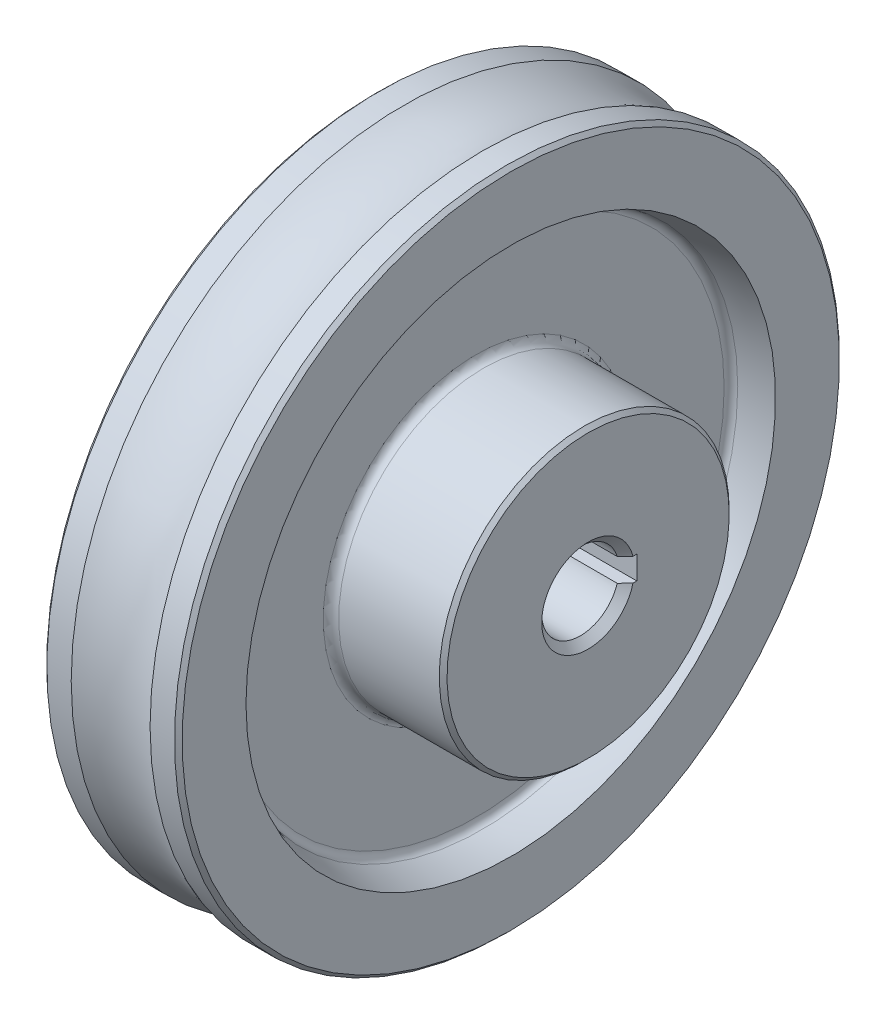
from build123d import *

# Parameters (mm, degrees)
CROQUIS2_R                        = 27
CROQUIS4_R                        = 10
CORTAR_EXTRUIR1_DEPTH             = 134.4803358
CHAFL_N1_SIZE                     = 1
CHAFL_N2_SIZE                     = 2
REDONDEO3_R                       = 2
REDONDEO5_R                       = 2
CORTAR_EXTRUIR2_REACH             = 129.272
CORTAR_EXTRUIR2_DIRECTION_2_REACH = 129.272


with BuildPart() as part:
    # Croquis1 → Revolución1 (revolve)
    with BuildSketch(Plane.XY):
        Polygon((-17.5, 0), (17.5, 0), (37.5, 0), (37.5, 37.5), (17.5, 37.5), (17.5, 86), (-17.5, 86), align=None)
    revolve(axis=Axis((0, 0, 0), (-1, 0, 0)))

    # Croquis2 → Cortar-Revolución1 (revolve, cut)
    with BuildSketch(Plane.XY):
        with Locations((0, 111)):
            Circle(CROQUIS2_R)
    revolve(axis=Axis((0, 0, 0), (-1, 0, 0)), mode=Mode.SUBTRACT)

    # Croquis3 → Cortar-Revolución2 (revolve, cut)
    with BuildSketch(Plane.XY, mode=Mode.PRIVATE) as cortar_revoluci_n2_sk:
        with BuildLine():
            Line((-8.5, 37.5), (-8.5, 65.830873376))
            ThreePointArc((-8.5, 65.830873376), (-13.06832274, 66.93505996), (-17.5, 68.5))
            Line((-17.5, 68.5), (-17.5, 37.5))
            Line((-17.5, 37.5), (-8.5, 37.5))
        make_face()
        with BuildLine():
            Line((8.5, 37.5), (8.5, 65.830873376))
            ThreePointArc((8.5, 65.830873376), (13.06832274, 66.93505996), (17.5, 68.5))
            Line((17.5, 68.5), (17.5, 37.5))
            Line((17.5, 37.5), (8.5, 37.5))
        make_face()
    revolve(cortar_revoluci_n2_sk.sketch.rotate(Axis((0, 0, 0), (1, 0, 0)), 90), axis=Axis((0, 0, 0), (1, 0, 0)), mode=Mode.SUBTRACT)

    # Croquis4 → Cortar-Extruir1 (cut, through all)
    with BuildSketch(Plane(origin=(37.5, 0, 0), x_dir=(0, 0, -1), z_dir=(1, 0, 0))):
        with Locations(Location((0, 0, 0), (0, 0, 90))):
            Circle(CROQUIS4_R)
    extrude(amount=-CORTAR_EXTRUIR1_DEPTH, mode=Mode.SUBTRACT)

    # Chaflán1
    chafl_n1_edges = [part.edges().sort_by_distance(p)[0] for p in [
        (-17.5, 0, -37.5),
        (37.5, -37.5, 0),
        (17.5, -86, 0),
        (-17.5, -86, 0),
    ]]
    chamfer(chafl_n1_edges, length=CHAFL_N1_SIZE)

    # Chaflán2
    chafl_n2_edges = [part.edges().sort_by_distance(p)[0] for p in [
        (-17.5, -10, 0),
        (37.5, -10, 0),
    ]]
    chamfer(chafl_n2_edges, length=CHAFL_N2_SIZE)

    # Redondeo3
    redondeo3_edges = [part.edges().sort_by_distance(p)[0] for p in [
        (-8.5, 0, -65.830873376),
        (8.5, 0, -65.830873376),
    ]]
    fillet(redondeo3_edges, radius=REDONDEO3_R)

    # Redondeo5
    redondeo5_edges = [part.edges().sort_by_distance(p)[0] for p in [
        (-8.5, 0, -37.5),
        (8.5, 0, -37.5),
    ]]
    fillet(redondeo5_edges, radius=REDONDEO5_R)

    # Cortar-Extruir2: up to this face of the body (flat: up to its plane)
    cortar_extruir2_end = Plane(part.part.faces().sort_by_distance((-17.5, -13.032375901, 0))[0])
    # Croquis5 → Cortar-Extruir2 (cut, up to the picked face)
    with BuildSketch(Plane(origin=(0, 0, 0), x_dir=(0, 0, -1), z_dir=(1, 0, 0)), mode=Mode.PRIVATE) as cortar_extruir2_sk1:
        with BuildLine():
            Line((12.6, 0), (12.6, 3))
            Line((12.6, 3), (9.539392014, 3))
            ThreePointArc((9.539392014, 3), (10, 0), (9.539392014, -3))
            Line((9.539392014, -3), (12.6, -3))
            Line((12.6, -3), (12.6, 0))
        make_face()
    cortar_extruir2_tool1 = split(extrude(cortar_extruir2_sk1.sketch, amount=-CORTAR_EXTRUIR2_REACH, mode=Mode.PRIVATE), bisect_by=cortar_extruir2_end, keep=Keep.BOTH, mode=Mode.PRIVATE)
    add(cortar_extruir2_tool1.solids().sort_by(Axis((0, 0, -11.220551), (-1, 0, 0)))[0], mode=Mode.SUBTRACT)

    # Cortar-Extruir2 direction 2: up to this face of the body (flat: up to its plane)
    cortar_extruir2_direction_2_end = Plane(part.part.faces().sort_by_distance((37.5, -13.032375901, 0))[0])
    # Croquis5 → Cortar-Extruir2 direction 2 (cut, up to the picked face)
    with BuildSketch(Plane(origin=(0, 0, 0), x_dir=(0, 0, -1), z_dir=(1, 0, 0)), mode=Mode.PRIVATE) as cortar_extruir2_direction_2_sk1:
        with BuildLine():
            Line((12.6, 0), (12.6, 3))
            Line((12.6, 3), (9.539392014, 3))
            ThreePointArc((9.539392014, 3), (10, 0), (9.539392014, -3))
            Line((9.539392014, -3), (12.6, -3))
            Line((12.6, -3), (12.6, 0))
        make_face()
    cortar_extruir2_direction_2_tool1 = split(extrude(cortar_extruir2_direction_2_sk1.sketch, amount=CORTAR_EXTRUIR2_DIRECTION_2_REACH, mode=Mode.PRIVATE), bisect_by=cortar_extruir2_direction_2_end, keep=Keep.BOTH, mode=Mode.PRIVATE)
    add(cortar_extruir2_direction_2_tool1.solids().sort_by(Axis((0, 0, -11.220551), (1, 0, 0)))[0], mode=Mode.SUBTRACT)


solid = part.part
